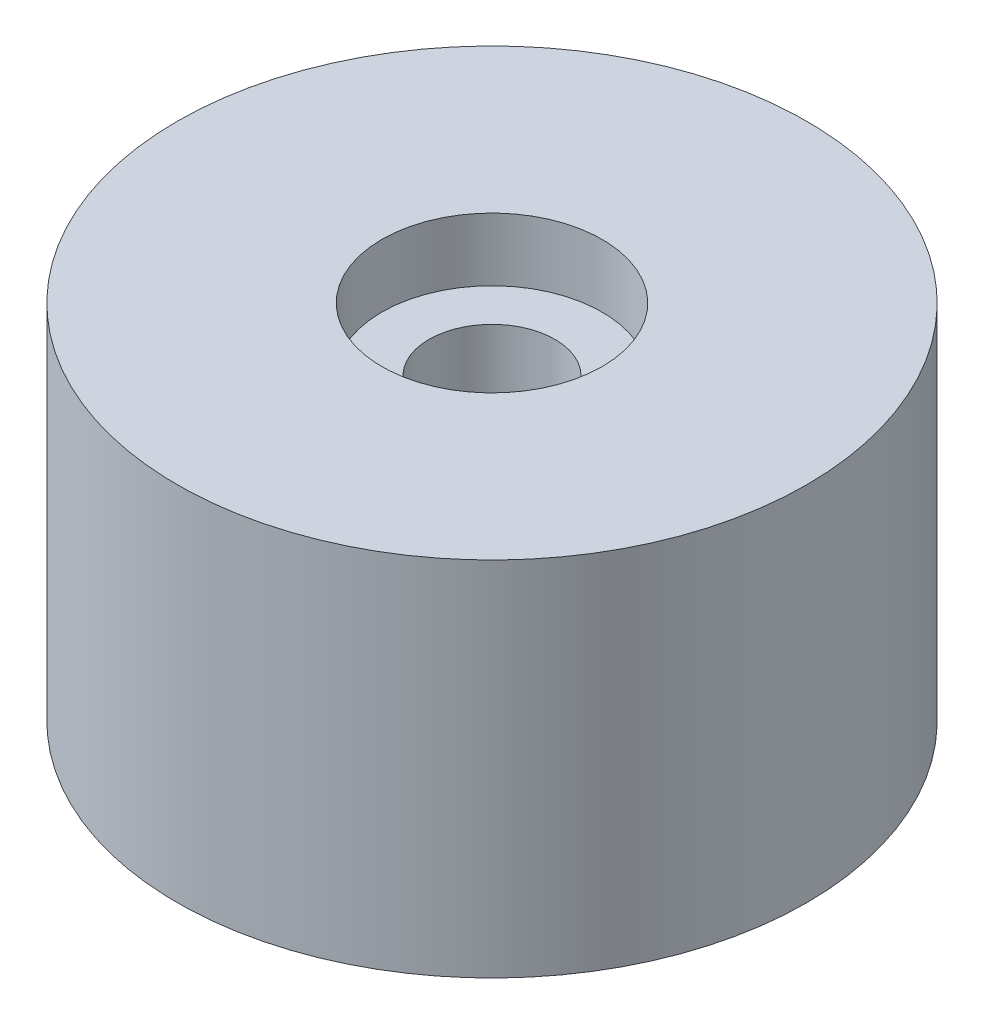
from build123d import *


with BuildPart() as part:
    # Эскиз1 → Повернуть1 (revolve)
    with BuildSketch(Plane.XY, mode=Mode.PRIVATE) as revolve_1_sk:
        Polygon((0, 3), (0, 0), (20, 0), (20, 23), (7, 23), (7, 19), (4, 19), (4, 3), align=None)
    revolve(revolve_1_sk.sketch.rotate(Axis((0, 3, 0), (0, -1, 0)), 180), axis=Axis((0, 3, 0), (0, -1, 0)))


solid = part.part
